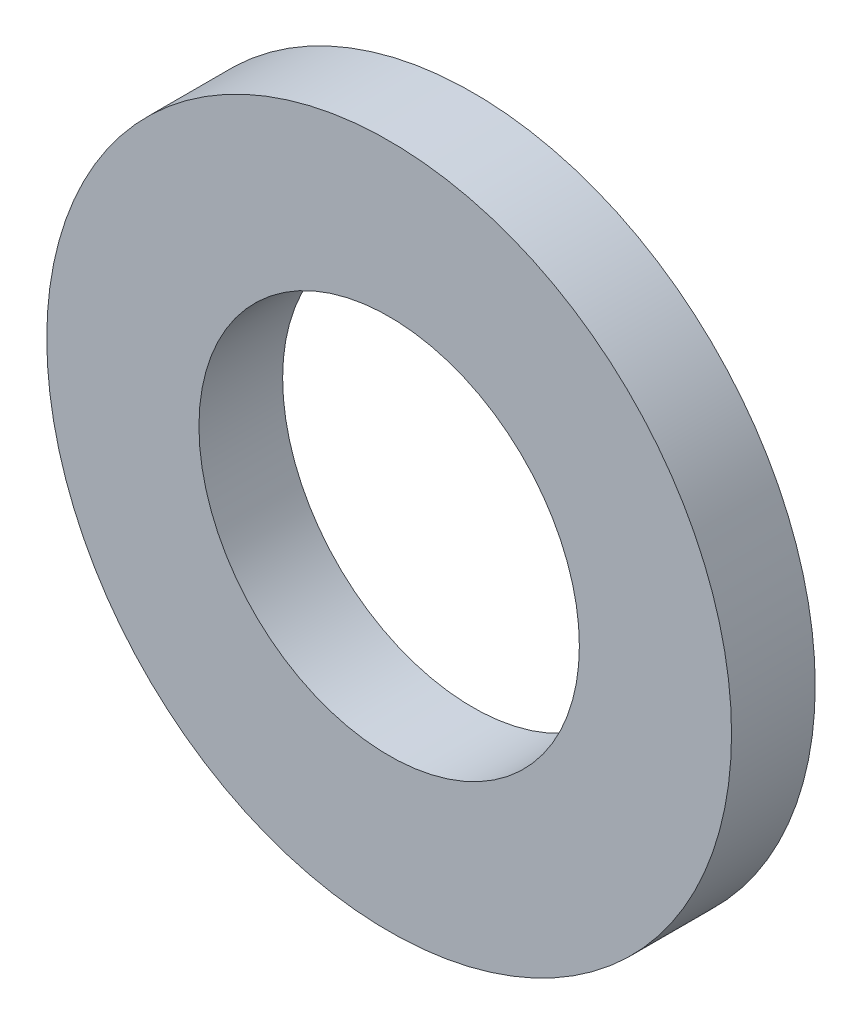
from build123d import *

# Parameters (mm, degrees)
SKETCH1_R           = 22.5
SKETCH1_R_2         = 12.5
BOSS_EXTRUDE1_DEPTH = 5.5


with BuildPart() as part:
    # Sketch1 → Boss-Extrude1 (new body)
    with BuildSketch(Plane.XY):
        Circle(SKETCH1_R)
        Circle(SKETCH1_R_2, mode=Mode.SUBTRACT)
    extrude(amount=BOSS_EXTRUDE1_DEPTH)


solid = part.part
